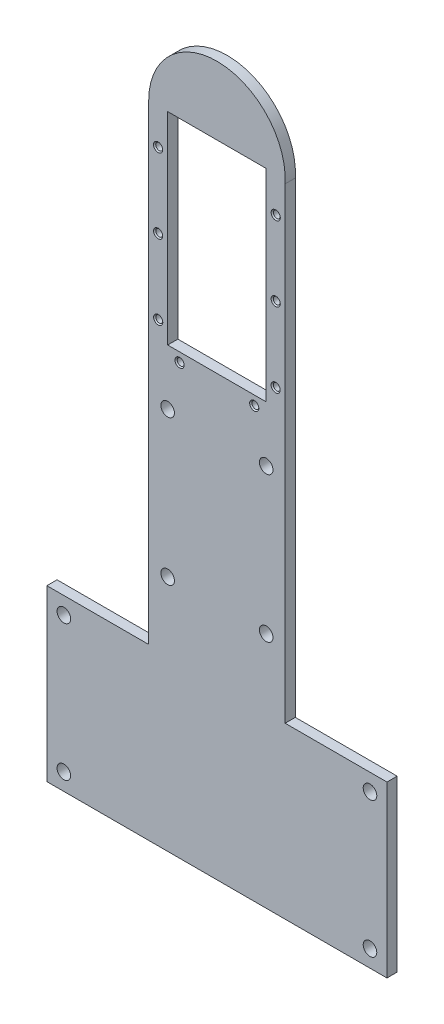
from build123d import *

# Parameters (mm, degrees)
ESBO_O1_R                = 2
ESBO_O1_R_2              = 1.025
ESBO_O1_W                = 29.025
ESBO_O1_H                = 59.55
RESSALTO_EXTRUS_O2_DEPTH = 3
CHANFRO1_SIZE            = 0.325


with BuildPart() as part:
    # Esboço1 → Ressalto-extrusão2 (new body)
    with BuildSketch(Plane.XY):
        with BuildLine():
            Line((-20.103801855, 0.75392245), (-20.103801855, -138))
            Line((-20.103801855, -138), (-50.103801855, -138))
            Line((-50.103801855, -138), (-50.103801855, -188))
            Line((-50.103801855, -188), (50.096198145, -188))
            Line((50.096198145, -188), (50.096198145, -138))
            Line((50.096198145, -138), (20.096198145, -138))
            Line((20.096198145, -138), (20.096198145, -0.390922156))
            ThreePointArc((20.096198145, -0.390922156), (0.585154384, 20.862071726), (-20.103801855, 0.75392245))
        make_face()
        with Locations((45.096198145, -143)):
            Circle(ESBO_O1_R, mode=Mode.SUBTRACT)
        with Locations((45.096198145, -183)):
            Circle(ESBO_O1_R, mode=Mode.SUBTRACT)
        with Locations((-45.096198145, -183)):
            Circle(ESBO_O1_R, mode=Mode.SUBTRACT)
        with Locations((-45.096198145, -143)):
            Circle(ESBO_O1_R, mode=Mode.SUBTRACT)
        with Locations((14.516198145, -75.169414559)):
            Circle(ESBO_O1_R, mode=Mode.SUBTRACT)
        with Locations((14.516198145, -117.953999713)):
            Circle(ESBO_O1_R, mode=Mode.SUBTRACT)
        with Locations((-14.516198145, -117.953999713)):
            Circle(ESBO_O1_R, mode=Mode.SUBTRACT)
        with Locations((-14.516198145, -75.169414559)):
            Circle(ESBO_O1_R, mode=Mode.SUBTRACT)
        with Locations((17.325, -9.74607755)):
            Circle(ESBO_O1_R_2, mode=Mode.SUBTRACT)
        with Locations((-17.325, -9.74607755)):
            Circle(ESBO_O1_R_2, mode=Mode.SUBTRACT)
        with Locations((17.3125, -31.746073996)):
            Circle(ESBO_O1_R_2, mode=Mode.SUBTRACT)
        with Locations((17.3, -53.746070443)):
            Circle(ESBO_O1_R_2, mode=Mode.SUBTRACT)
        with Locations((-17.3, -53.746070443)):
            Circle(ESBO_O1_R_2, mode=Mode.SUBTRACT)
        with Locations((-17.3125, -31.746073996)):
            Circle(ESBO_O1_R_2, mode=Mode.SUBTRACT)
        with Locations((11, -61.546070443)):
            Circle(ESBO_O1_R_2, mode=Mode.SUBTRACT)
        with Locations((-11, -61.546070443)):
            Circle(ESBO_O1_R_2, mode=Mode.SUBTRACT)
        with Locations((0.0125, -29.02107755)):
            Rectangle(ESBO_O1_W, ESBO_O1_H, mode=Mode.SUBTRACT)
    extrude(amount=RESSALTO_EXTRUS_O2_DEPTH)

    # Chanfro1
    chanfro1_edges = [part.edges().sort_by_distance(p)[0] for p in [
        (16.2875, -31.746073996, 3),
        (16.275, -53.746070443, 3),
        (-18.325, -53.746070443, 3),
        (9.975, -61.546070443, 3),
        (-12.025, -61.546070443, 3),
        (-18.3375, -31.746073996, 3),
        (-18.35, -9.74607755, 3),
        (16.3, -9.74607755, 3),
    ]]
    chamfer(chanfro1_edges, length=CHANFRO1_SIZE)


solid = part.part
